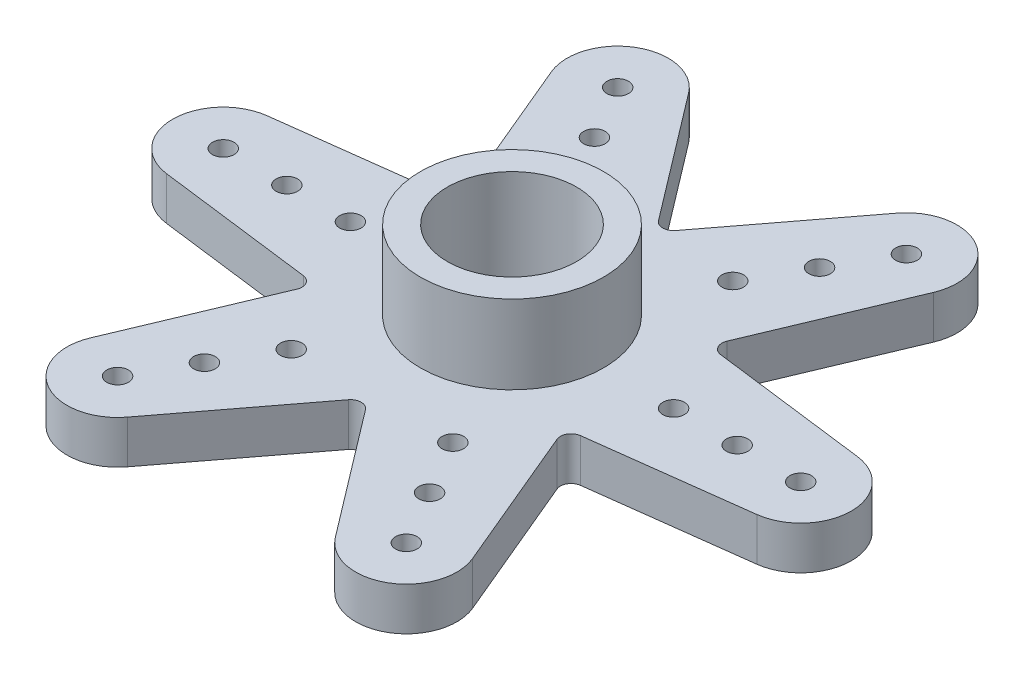
from build123d import *

# Parameters (mm, degrees)
SKETCH1_R           = 3
SKETCH1_R_2         = 0.5
BOSS_EXTRUDE1_DEPTH = 2
SKETCH2_R           = 4.25
SKETCH2_R_2         = 3
BOSS_EXTRUDE2_DEPTH = 3.65


with BuildPart() as part:
    # Sketch1 → Boss-Extrude1 (new body)
    with BuildSketch(Plane(origin=(0, 0, 0), x_dir=(1, 0, 0), z_dir=(0, 1, 0))):
        with BuildLine():
            Line((13.696134198, 2.331266724), (6.432183252, 3.253985803))
            ThreePointArc((6.432183252, 3.253985803), (6.062177826, 3.5), (6.034125995, 3.943441197))
            Line((6.034125995, 3.943441197), (8.867003305, 10.695566787))
            ThreePointArc((8.867003305, 10.695566787), (7.875, 13.63990011), (4.829130893, 13.026833511))
            Line((4.829130893, 13.026833511), (0.398057257, 7.197427))
            ThreePointArc((0.398057257, 7.197427), (0, 7), (-0.398057257, 7.197427))
            Line((-0.398057257, 7.197427), (-4.829130893, 13.026833511))
            ThreePointArc((-4.829130893, 13.026833511), (-7.875, 13.63990011), (-8.867003305, 10.695566787))
            Line((-8.867003305, 10.695566787), (-6.034125995, 3.943441197))
            ThreePointArc((-6.034125995, 3.943441197), (-6.062177826, 3.5), (-6.432183252, 3.253985803))
            Line((-6.432183252, 3.253985803), (-13.696134198, 2.331266724))
            ThreePointArc((-13.696134198, 2.331266724), (-15.75, 0), (-13.696134198, -2.331266724))
            Line((-13.696134198, -2.331266724), (-6.432183252, -3.253985803))
            ThreePointArc((-6.432183252, -3.253985803), (-6.062177826, -3.5), (-6.034125995, -3.943441197))
            Line((-6.034125995, -3.943441197), (-8.867003305, -10.695566787))
            ThreePointArc((-8.867003305, -10.695566787), (-7.875, -13.63990011), (-4.829130893, -13.026833511))
            Line((-4.829130893, -13.026833511), (-0.398057257, -7.197427))
            ThreePointArc((-0.398057257, -7.197427), (0, -7), (0.398057257, -7.197427))
            Line((0.398057257, -7.197427), (4.829130893, -13.026833511))
            ThreePointArc((4.829130893, -13.026833511), (7.875, -13.63990011), (8.867003305, -10.695566787))
            Line((8.867003305, -10.695566787), (6.034125995, -3.943441197))
            ThreePointArc((6.034125995, -3.943441197), (6.062177826, -3.5), (6.432183252, -3.253985803))
            Line((6.432183252, -3.253985803), (13.696134198, -2.331266724))
            ThreePointArc((13.696134198, -2.331266724), (15.75, 0), (13.696134198, 2.331266724))
        make_face()
        with Locations(Location((0, 0, 0), (0, 0, 270))):
            Circle(SKETCH1_R, mode=Mode.SUBTRACT)
        with Locations(Location((7.5, 0, 0), (0, 0, 270))):
            Circle(SKETCH1_R_2, mode=Mode.SUBTRACT)
        with Locations(Location((10.45, 0, 0), (0, 0, 270))):
            Circle(SKETCH1_R_2, mode=Mode.SUBTRACT)
        with Locations(Location((13.4, 0, 0), (0, 0, 270))):
            Circle(SKETCH1_R_2, mode=Mode.SUBTRACT)
        with Locations(Location((3.75, -6.495190528, 0), (0, 0, 270))):
            Circle(SKETCH1_R_2, mode=Mode.SUBTRACT)
        with Locations(Location((5.225, -9.04996547, 0), (0, 0, 270))):
            Circle(SKETCH1_R_2, mode=Mode.SUBTRACT)
        with Locations(Location((6.7, -11.604740411, 0), (0, 0, 270))):
            Circle(SKETCH1_R_2, mode=Mode.SUBTRACT)
        with Locations(Location((-3.75, -6.495190528, 0), (0, 0, 270))):
            Circle(SKETCH1_R_2, mode=Mode.SUBTRACT)
        with Locations(Location((-5.225, -9.04996547, 0), (0, 0, 270))):
            Circle(SKETCH1_R_2, mode=Mode.SUBTRACT)
        with Locations(Location((-6.7, -11.604740411, 0), (0, 0, 270))):
            Circle(SKETCH1_R_2, mode=Mode.SUBTRACT)
        with Locations(Location((-7.5, 0, 0), (0, 0, 270))):
            Circle(SKETCH1_R_2, mode=Mode.SUBTRACT)
        with Locations(Location((-10.45, 0, 0), (0, 0, 270))):
            Circle(SKETCH1_R_2, mode=Mode.SUBTRACT)
        with Locations(Location((-13.4, 0, 0), (0, 0, 270))):
            Circle(SKETCH1_R_2, mode=Mode.SUBTRACT)
        with Locations(Location((-3.75, 6.495190528, 0), (0, 0, 270))):
            Circle(SKETCH1_R_2, mode=Mode.SUBTRACT)
        with Locations(Location((-5.225, 9.04996547, 0), (0, 0, 270))):
            Circle(SKETCH1_R_2, mode=Mode.SUBTRACT)
        with Locations(Location((-6.7, 11.604740411, 0), (0, 0, 270))):
            Circle(SKETCH1_R_2, mode=Mode.SUBTRACT)
        with Locations(Location((3.75, 6.495190528, 0), (0, 0, 270))):
            Circle(SKETCH1_R_2, mode=Mode.SUBTRACT)
        with Locations(Location((5.225, 9.04996547, 0), (0, 0, 270))):
            Circle(SKETCH1_R_2, mode=Mode.SUBTRACT)
        with Locations(Location((6.7, 11.604740411, 0), (0, 0, 270))):
            Circle(SKETCH1_R_2, mode=Mode.SUBTRACT)
    extrude(amount=BOSS_EXTRUDE1_DEPTH)

    # Sketch2 → Boss-Extrude2 (add)
    with BuildSketch(Plane(origin=(0, 2, 0), x_dir=(-1, 0, 0), z_dir=(0, 1, 0))):
        with Locations(Location((0, 0, 0), (0, 0, 90))):
            Circle(SKETCH2_R)
        with Locations(Location((0, 0, 0), (0, 0, 90))):
            Circle(SKETCH2_R_2, mode=Mode.SUBTRACT)
    extrude(amount=BOSS_EXTRUDE2_DEPTH)


solid = part.part
